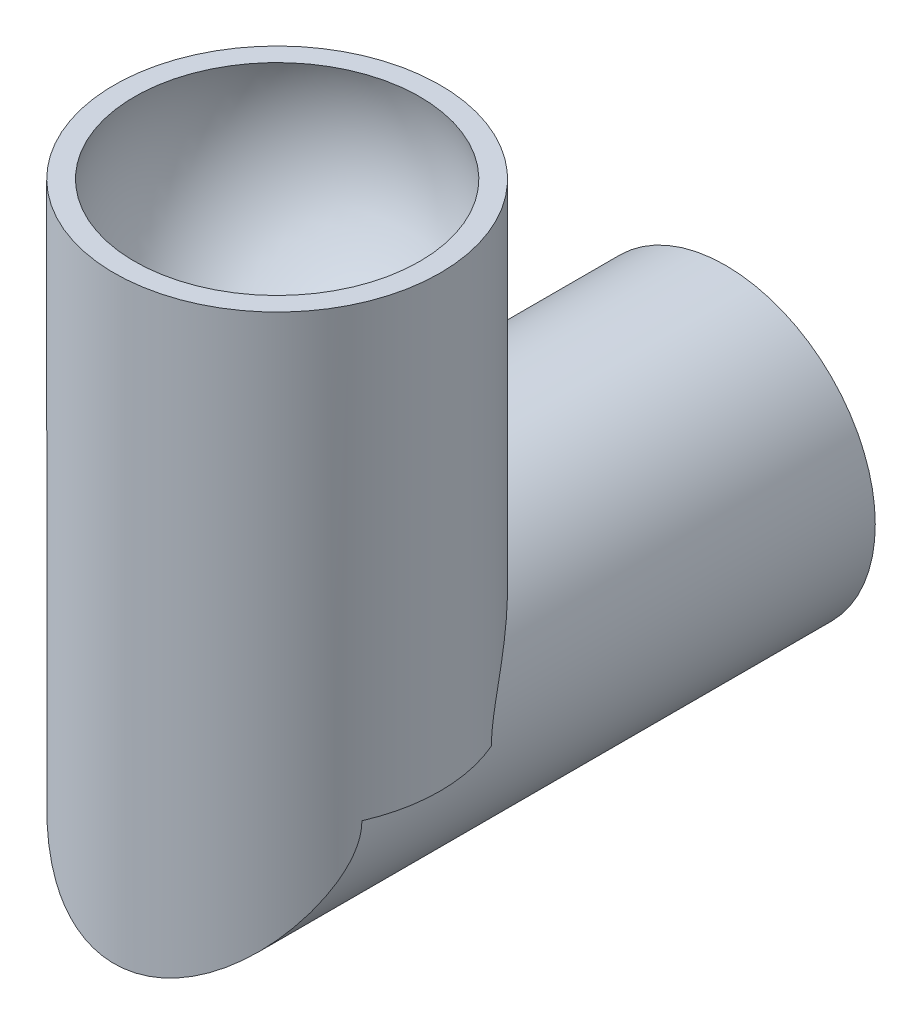
from build123d import *

# Parameters (mm, degrees)
SKETCH_5_R                       = 20
EXTRUDE_1_DEPTH                  = 60
EXTRUDE_1_DIRECTION_2_REACH      = 64.177
EXTRUDE_1_DIRECTION_2_END_RADIUS = 21.794494718
SKETCH_7_R                       = 10


with BuildPart() as part:
    # Sweep 1: sweep along a path in 草图2
    with BuildLine(Plane(origin=(0, 0, 0), x_dir=(1, 0, 0), z_dir=(0, 1, 0))) as sweep_1_path:
        CenterArc((0, 0), 11, 0, 360)
    # 草图1 → Sweep 1 (sweep)
    with BuildSketch(Plane.XY):
        with BuildLine():
            Line((21.794494718, 6), (21.794494718, -54))
            Line((21.794494718, -54), (0, -54))
            Line((0, -54), (0, -20))
            ThreePointArc((0, -20), (16.124515497, -11.832159566), (19.078784028, 6))
            Line((19.078784028, 6), (21.794494718, 6))
        make_face()
    sweep(path=sweep_1_path.line)

    # 草图5 → 凸台-拉伸1 (add)
    with BuildSketch(Plane.XY):
        with Locations((0, -54)):
            Circle(SKETCH_5_R)
    extrude(amount=-EXTRUDE_1_DEPTH)

    # 凸台-拉伸1 direction 2: up to this cylinder (the profile starts inside it)
    extrude_1_direction_2_end = Plane(origin=(0, -54, 0), z_dir=(0, 1, 0)) * Cylinder(EXTRUDE_1_DIRECTION_2_END_RADIUS, 172.942989435, mode=Mode.PRIVATE)
    # 草图5 → 凸台-拉伸1 direction 2 (add, up to the surface)
    with BuildSketch(Plane.XY, mode=Mode.PRIVATE) as extrude_1_direction_2_sk1:
        with Locations((0, -54)):
            Circle(SKETCH_5_R)
    extrude_1_direction_2_tool1 = extrude(extrude_1_direction_2_sk1.sketch, amount=EXTRUDE_1_DIRECTION_2_REACH, mode=Mode.PRIVATE) & extrude_1_direction_2_end
    add(extrude_1_direction_2_tool1.solids().sort_by_distance((0, -54, 0))[0])

    # Sweep 1 2: sweep along a path in 草图6
    with BuildLine(Plane(origin=(0, 0, 0), x_dir=(0, 0, -1), z_dir=(1, 0, 0))) as sweep_1_2_path:
        Line((60, -54), (0, -54))
        Line((0, -54), (0, 6))
    # 草图7 → Sweep 1 2 (sweep, cut)
    with BuildSketch(Plane(origin=(0, 0, -60), x_dir=(-1, 0, 0), z_dir=(0, 0, -1))):
        with Locations((0, -54)):
            Circle(SKETCH_7_R)
    sweep(path=sweep_1_2_path.line, transition=Transition.RIGHT, mode=Mode.SUBTRACT)


solid = part.part
